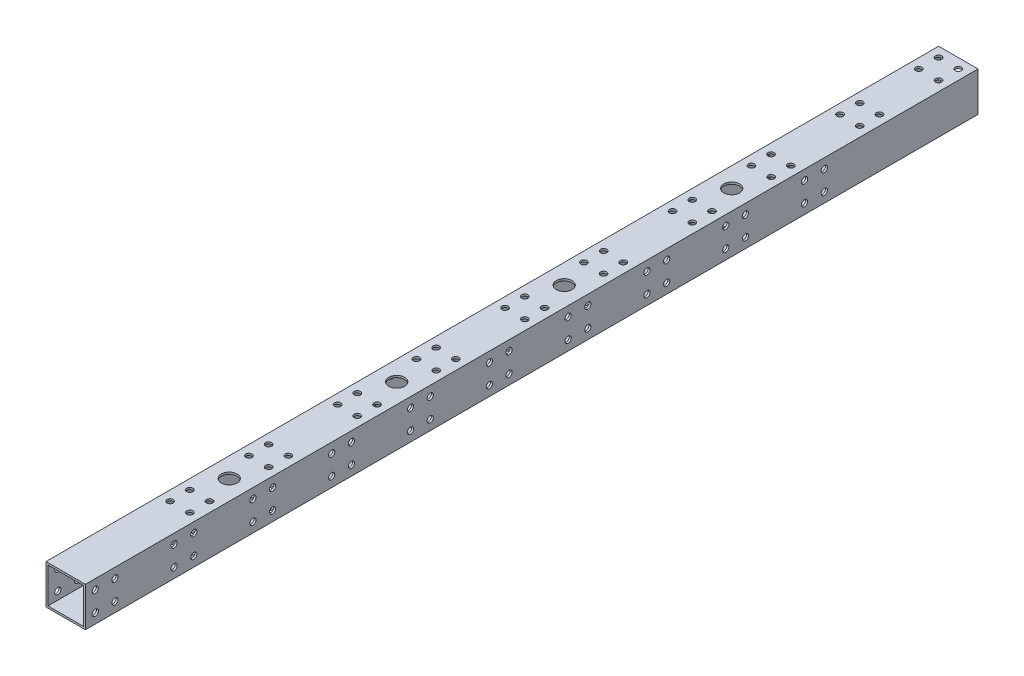
from build123d import *

# Parameters (mm, degrees)
SKETCH_1_W          = 20
SKETCH_1_H          = 20
SKETCH_1_W_2        = 18
SKETCH_1_H_2        = 18
EXTRUDE_1_DEPTH     = 453
SKETCH_2_R          = 1.575
CUT_EXTRUDE_1_DEPTH = 454.882143293
SKETCH_4_R          = 1.575
SKETCH_4_R_2        = 4
CUT_EXTRUDE_2_DEPTH = 454.882143293


with BuildPart() as part:
    # 草图1 → 拉伸-薄壁1 (new body)
    with BuildSketch(Plane.XY):
        with Locations((10, -10)):
            Rectangle(SKETCH_1_W, SKETCH_1_H)
        with Locations((10, -10)):
            Rectangle(SKETCH_1_W_2, SKETCH_1_H_2, mode=Mode.SUBTRACT)
    extrude(amount=EXTRUDE_1_DEPTH)

    # 草图2 → 切除-拉伸1 (cut, through all)
    with BuildSketch(Plane(origin=(20, 0, 0), x_dir=(0, 0, -1), z_dir=(1, 0, 0))):
        with Locations(Location((-448, -5, 0), (0, 0, 90))):
            Circle(SKETCH_2_R)
        with Locations(Location((-448, -15, 0), (0, 0, 270))):
            Circle(SKETCH_2_R)
        with Locations(Location((-438, -15, 0), (0, 0, 90))):
            Circle(SKETCH_2_R)
        with Locations(Location((-438, -5, 0), (0, 0, 270))):
            Circle(SKETCH_2_R)
        with Locations(Location((-408, -5, 0), (0, 0, 90))):
            Circle(SKETCH_2_R)
        with Locations(Location((-398, -5, 0), (0, 0, 270))):
            Circle(SKETCH_2_R)
        with Locations(Location((-398, -15, 0), (0, 0, 90))):
            Circle(SKETCH_2_R)
        with Locations(Location((-408, -15, 0), (0, 0, 270))):
            Circle(SKETCH_2_R)
        with Locations(Location((-368, -5, 0), (0, 0, 90))):
            Circle(SKETCH_2_R)
        with Locations(Location((-358, -5, 0), (0, 0, 270))):
            Circle(SKETCH_2_R)
        with Locations(Location((-358, -15, 0), (0, 0, 90))):
            Circle(SKETCH_2_R)
        with Locations(Location((-368, -15, 0), (0, 0, 270))):
            Circle(SKETCH_2_R)
        with Locations(Location((-328, -5, 0), (0, 0, 90))):
            Circle(SKETCH_2_R)
        with Locations(Location((-318, -5, 0), (0, 0, 270))):
            Circle(SKETCH_2_R)
        with Locations(Location((-318, -15, 0), (0, 0, 90))):
            Circle(SKETCH_2_R)
        with Locations(Location((-328, -15, 0), (0, 0, 270))):
            Circle(SKETCH_2_R)
        with Locations(Location((-288, -5, 0), (0, 0, 90))):
            Circle(SKETCH_2_R)
        with Locations(Location((-278, -5, 0), (0, 0, 270))):
            Circle(SKETCH_2_R)
        with Locations(Location((-278, -15, 0), (0, 0, 90))):
            Circle(SKETCH_2_R)
        with Locations(Location((-288, -15, 0), (0, 0, 270))):
            Circle(SKETCH_2_R)
        with Locations(Location((-248, -5, 0), (0, 0, 90))):
            Circle(SKETCH_2_R)
        with Locations(Location((-238, -5, 0), (0, 0, 270))):
            Circle(SKETCH_2_R)
        with Locations(Location((-238, -15, 0), (0, 0, 90))):
            Circle(SKETCH_2_R)
        with Locations(Location((-248, -15, 0), (0, 0, 270))):
            Circle(SKETCH_2_R)
        with Locations(Location((-208, -5, 0), (0, 0, 90))):
            Circle(SKETCH_2_R)
        with Locations(Location((-198, -5, 0), (0, 0, 270))):
            Circle(SKETCH_2_R)
        with Locations(Location((-198, -15, 0), (0, 0, 90))):
            Circle(SKETCH_2_R)
        with Locations(Location((-208, -15, 0), (0, 0, 270))):
            Circle(SKETCH_2_R)
        with Locations(Location((-168, -5, 0), (0, 0, 90))):
            Circle(SKETCH_2_R)
        with Locations(Location((-158, -5, 0), (0, 0, 270))):
            Circle(SKETCH_2_R)
        with Locations(Location((-158, -15, 0), (0, 0, 90))):
            Circle(SKETCH_2_R)
        with Locations(Location((-168, -15, 0), (0, 0, 270))):
            Circle(SKETCH_2_R)
        with Locations(Location((-128, -5, 0), (0, 0, 90))):
            Circle(SKETCH_2_R)
        with Locations(Location((-118, -5, 0), (0, 0, 270))):
            Circle(SKETCH_2_R)
        with Locations(Location((-118, -15, 0), (0, 0, 90))):
            Circle(SKETCH_2_R)
        with Locations(Location((-128, -15, 0), (0, 0, 270))):
            Circle(SKETCH_2_R)
        with Locations(Location((-88, -5, 0), (0, 0, 90))):
            Circle(SKETCH_2_R)
        with Locations(Location((-78, -5, 0), (0, 0, 270))):
            Circle(SKETCH_2_R)
        with Locations(Location((-78, -15, 0), (0, 0, 90))):
            Circle(SKETCH_2_R)
        with Locations(Location((-88, -15, 0), (0, 0, 270))):
            Circle(SKETCH_2_R)
    extrude(amount=-CUT_EXTRUDE_1_DEPTH, mode=Mode.SUBTRACT)

    # 草图4 → 切除-拉伸2 (cut, through all)
    with BuildSketch(Plane.XZ.offset(20)):
        with Locations(Location((5, 5, 0), (0, 0, 270))):
            Circle(SKETCH_4_R)
        with Locations(Location((15, 5, 0), (0, 0, 270))):
            Circle(SKETCH_4_R)
        with Locations(Location((15, 15, 0), (0, 0, 270))):
            Circle(SKETCH_4_R)
        with Locations(Location((5, 15, 0), (0, 0, 270))):
            Circle(SKETCH_4_R)
        with Locations(Location((5, 45, 0), (0, 0, 270))):
            Circle(SKETCH_4_R)
        with Locations(Location((15, 45, 0), (0, 0, 270))):
            Circle(SKETCH_4_R)
        with Locations(Location((15, 55, 0), (0, 0, 270))):
            Circle(SKETCH_4_R)
        with Locations(Location((5, 55, 0), (0, 0, 270))):
            Circle(SKETCH_4_R)
        with Locations(Location((5, 140, 0), (0, 0, 270))):
            Circle(SKETCH_4_R)
        with Locations(Location((15, 140, 0), (0, 0, 270))):
            Circle(SKETCH_4_R)
        with Locations(Location((5, 130, 0), (0, 0, 270))):
            Circle(SKETCH_4_R)
        with Locations(Location((15, 130, 0), (0, 0, 270))):
            Circle(SKETCH_4_R)
        with Locations(Location((5, 100, 0), (0, 0, 270))):
            Circle(SKETCH_4_R)
        with Locations(Location((5, 90, 0), (0, 0, 270))):
            Circle(SKETCH_4_R)
        with Locations(Location((15, 100, 0), (0, 0, 270))):
            Circle(SKETCH_4_R)
        with Locations(Location((15, 90, 0), (0, 0, 270))):
            Circle(SKETCH_4_R)
        with Locations(Location((5, 225, 0), (0, 0, 270))):
            Circle(SKETCH_4_R)
        with Locations(Location((15, 225, 0), (0, 0, 270))):
            Circle(SKETCH_4_R)
        with Locations(Location((5, 215, 0), (0, 0, 270))):
            Circle(SKETCH_4_R)
        with Locations(Location((15, 215, 0), (0, 0, 270))):
            Circle(SKETCH_4_R)
        with Locations(Location((5, 185, 0), (0, 0, 270))):
            Circle(SKETCH_4_R)
        with Locations(Location((5, 175, 0), (0, 0, 270))):
            Circle(SKETCH_4_R)
        with Locations(Location((15, 185, 0), (0, 0, 270))):
            Circle(SKETCH_4_R)
        with Locations(Location((15, 175, 0), (0, 0, 270))):
            Circle(SKETCH_4_R)
        with Locations(Location((5, 310, 0), (0, 0, 270))):
            Circle(SKETCH_4_R)
        with Locations(Location((15, 310, 0), (0, 0, 270))):
            Circle(SKETCH_4_R)
        with Locations(Location((5, 300, 0), (0, 0, 270))):
            Circle(SKETCH_4_R)
        with Locations(Location((15, 300, 0), (0, 0, 270))):
            Circle(SKETCH_4_R)
        with Locations(Location((5, 270, 0), (0, 0, 270))):
            Circle(SKETCH_4_R)
        with Locations(Location((5, 260, 0), (0, 0, 270))):
            Circle(SKETCH_4_R)
        with Locations(Location((15, 270, 0), (0, 0, 270))):
            Circle(SKETCH_4_R)
        with Locations(Location((15, 260, 0), (0, 0, 270))):
            Circle(SKETCH_4_R)
        with Locations(Location((5, 395, 0), (0, 0, 270))):
            Circle(SKETCH_4_R)
        with Locations(Location((15, 395, 0), (0, 0, 270))):
            Circle(SKETCH_4_R)
        with Locations(Location((5, 385, 0), (0, 0, 270))):
            Circle(SKETCH_4_R)
        with Locations(Location((15, 385, 0), (0, 0, 270))):
            Circle(SKETCH_4_R)
        with Locations(Location((5, 355, 0), (0, 0, 270))):
            Circle(SKETCH_4_R)
        with Locations(Location((5, 345, 0), (0, 0, 270))):
            Circle(SKETCH_4_R)
        with Locations(Location((15, 355, 0), (0, 0, 270))):
            Circle(SKETCH_4_R)
        with Locations(Location((15, 345, 0), (0, 0, 270))):
            Circle(SKETCH_4_R)
        with Locations(Location((10, 115, 0), (0, 0, 270))):
            Circle(SKETCH_4_R_2)
        with Locations(Location((10, 200, 0), (0, 0, 270))):
            Circle(SKETCH_4_R_2)
        with Locations(Location((10, 285, 0), (0, 0, 270))):
            Circle(SKETCH_4_R_2)
        with Locations(Location((10, 370, 0), (0, 0, 270))):
            Circle(SKETCH_4_R_2)
    extrude(amount=-CUT_EXTRUDE_2_DEPTH, mode=Mode.SUBTRACT)


solid = part.part
